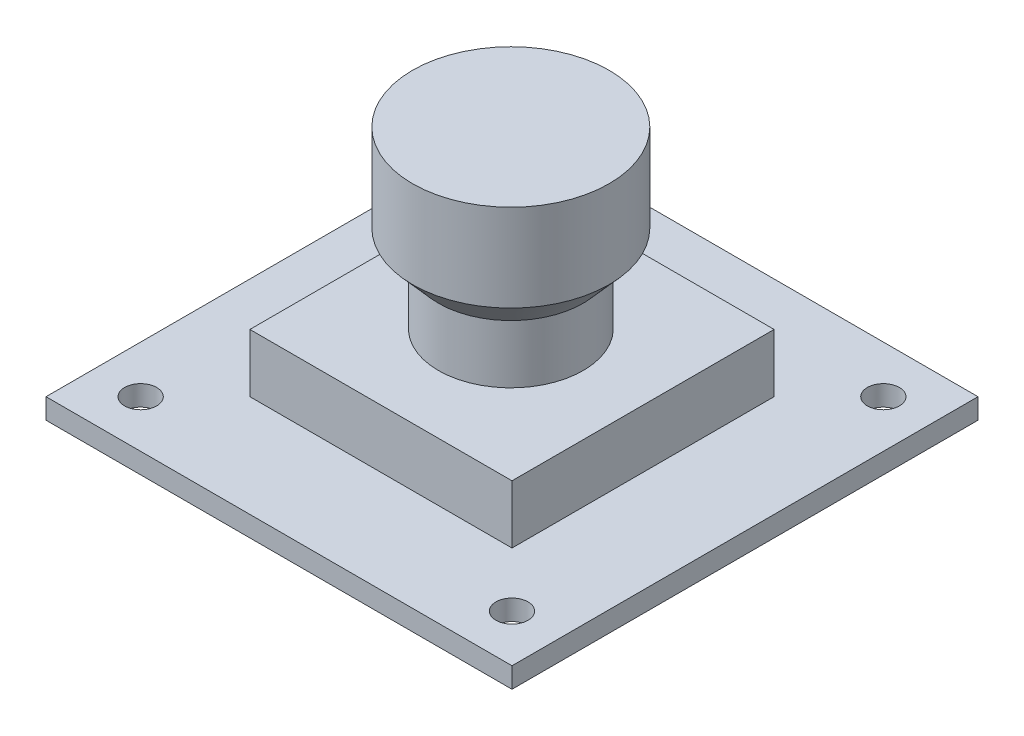
from build123d import *

# Parameters (mm, degrees)
SKETCH_1_W      = 32
SKETCH_1_H      = 32
SKETCH_1_R      = 1.1
EXTRUDE_1_DEPTH = 1.4
SKETCH_2_W      = 18
SKETCH_2_H      = 18
EXTRUDE_2_DEPTH = 4
SKETCH_3_R      = 6.75
EXTRUDE_3_DEPTH = 12
SKETCH_5_W      = 4
SKETCH_5_H      = 9
EXTRUDE_4_DEPTH = 8
SKETCH_6_R      = 0.531026099
EXTRUDE_5_DEPTH = 4


with BuildPart() as part:
    # 草图1 → 凸台-拉伸1 (new body)
    with BuildSketch(Plane(origin=(0, 0, 0), x_dir=(1, 0, 0), z_dir=(0, 1, 0))):
        with Locations((16, 16)):
            Rectangle(SKETCH_1_W, SKETCH_1_H)
        with Locations(Location((3.25, 28.75, 0), (0, 0, 270))):
            Circle(SKETCH_1_R, mode=Mode.SUBTRACT)
        with Locations(Location((28.75, 28.75, 0), (0, 0, 90))):
            Circle(SKETCH_1_R, mode=Mode.SUBTRACT)
        with Locations(Location((28.75, 3.25, 0), (0, 0, 270))):
            Circle(SKETCH_1_R, mode=Mode.SUBTRACT)
        with Locations(Location((3.25, 3.25, 0), (0, 0, 90))):
            Circle(SKETCH_1_R, mode=Mode.SUBTRACT)
    extrude(amount=EXTRUDE_1_DEPTH)

    # 草图2 → 凸台-拉伸2 (add)
    with BuildSketch(Plane(origin=(0, 1.4, 0), x_dir=(1, 0, 0), z_dir=(0, 1, 0))):
        with Locations((16, 16)):
            Rectangle(SKETCH_2_W, SKETCH_2_H)
    extrude(amount=EXTRUDE_2_DEPTH)

    # 草图3 → 凸台-拉伸3 (add)
    with BuildSketch(Plane(origin=(0, 5.4, 0), x_dir=(1, 0, 0), z_dir=(0, 1, 0))):
        with Locations(Location((15.920011352, 16, 0), (0, 0, 270))):
            Circle(SKETCH_3_R)
    extrude(amount=EXTRUDE_3_DEPTH)

    # 草图4 → 切除-旋转1 (revolve, cut)
    with BuildSketch(Plane.XY.offset(-16), mode=Mode.PRIVATE) as cut_revolve_1_sk:
        Polygon((9.170011352, 11.4), (10.947526868, 9.4), (10.947526868, 5.4), (9.170011352, 5.4), align=None)
    revolve(cut_revolve_1_sk.sketch.rotate(Axis((15.920011352, 17.4, -16), (0, -1, 0)), 270), axis=Axis((15.920011352, 17.4, -16), (0, -1, 0)), mode=Mode.SUBTRACT)

    # 草图5 → 凸台-拉伸4 (add)
    with BuildSketch(Plane.XZ):
        with Locations((2.249894635, -23.15)):
            Rectangle(SKETCH_5_W, SKETCH_5_H)
    extrude(amount=EXTRUDE_4_DEPTH)

    # 草图6 → 凸台-拉伸5 (add)
    with BuildSketch(Plane.XZ.offset(8)):
        with Locations(Location((1.950545413, -20.513721841, 0), (0, 0, 90))):
            Circle(SKETCH_6_R)
        with Locations(Location((1.950545413, -22.513721841, 0), (0, 0, 90))):
            Circle(SKETCH_6_R)
        with Locations(Location((1.950545413, -24.513721841, 0), (0, 0, 90))):
            Circle(SKETCH_6_R)
        with Locations(Location((1.950545413, -26.513721841, 0), (0, 0, 90))):
            Circle(SKETCH_6_R)
    extrude(amount=EXTRUDE_5_DEPTH)


solid = part.part
